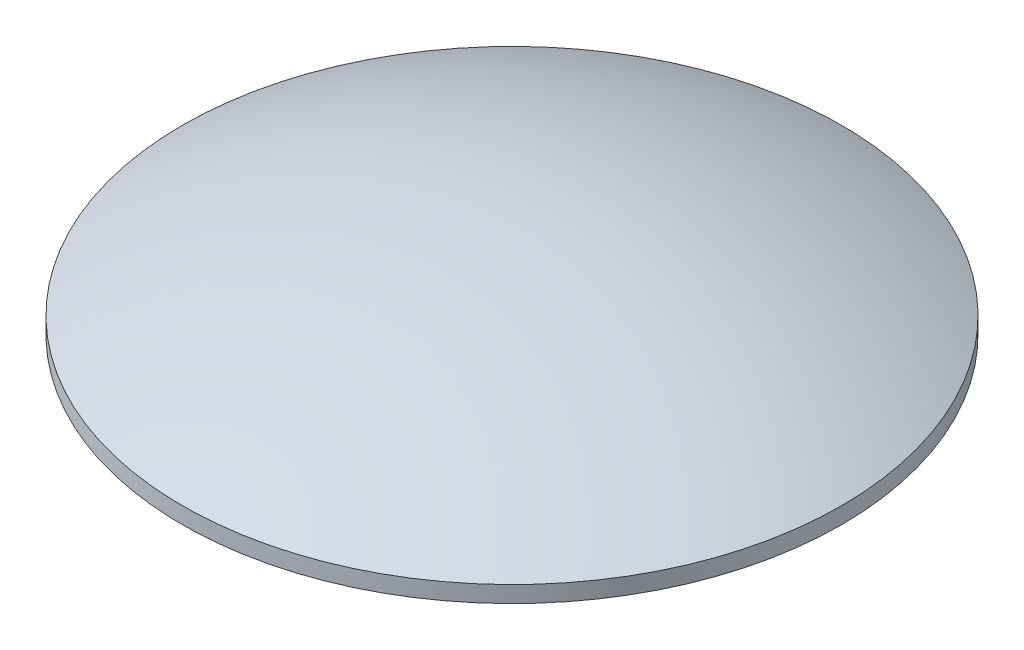
from build123d import *

# Parameters (mm, degrees)
SKETCH2_R           = 14
BOSS_EXTRUDE1_DEPTH = 1


with BuildPart() as part:
    # Sketch1 → Revolve1 (revolve)
    with BuildSketch(Plane.XY, mode=Mode.PRIVATE) as revolve1_sk:
        with BuildLine():
            Line((17.776388835, 1), (20, 1))
            ThreePointArc((20, 1), (10.307764064, 4.731056256), (0, 6))
            Line((0, 6), (0, 5))
            ThreePointArc((0, 5), (9.110433579, 3.987652439), (17.776388835, 1))
        make_face()
        Polygon((0, 1), (0, 0), (20, 0), (20, 1), (17.776388835, 1), align=None)
    revolve(revolve1_sk.sketch.rotate(Axis((0, 1, 0), (0, -1, 0)), 180), axis=Axis((0, 1, 0), (0, -1, 0)))


with BuildPart() as body_2:
    # Sketch2 → Boss-Extrude1 (new body)
    with BuildSketch(Plane(origin=(0, 1, 0), x_dir=(1, 0, 0), z_dir=(0, 1, 0))):
        with Locations(Location((0, -3.776388835, 0), (0, 0, 180))):
            Circle(SKETCH2_R)
    extrude(amount=BOSS_EXTRUDE1_DEPTH)


solid = Compound([part.part, body_2.part])
